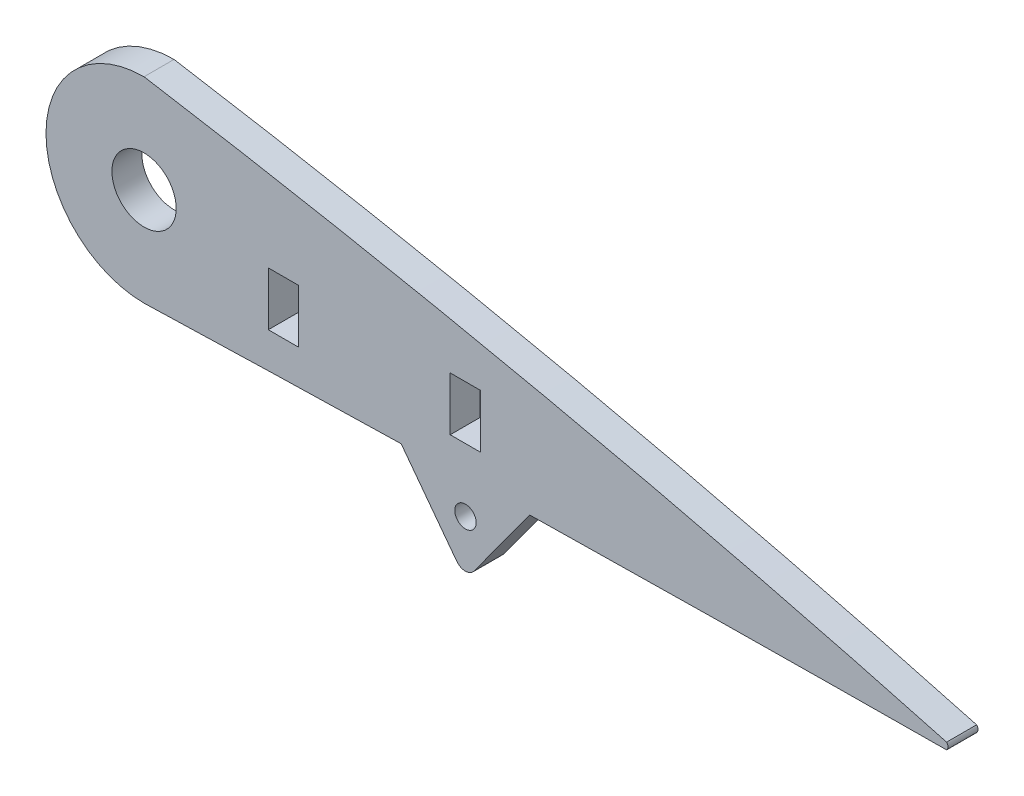
from build123d import *

# Parameters (mm, degrees)
SKETCH_1_R      = 1
SKETCH_1_R_2    = 3
SKETCH_1_W      = 2.8
SKETCH_1_H      = 5
SKETCH_1_W_2    = 2.85
EXTRUDE_1_DEPTH = 1.4


with BuildPart() as part:
    # Эскиз1 → Бобышка-Вытянуть1 (new, symmetric)
    with BuildSketch(Plane.XY):
        with BuildLine():
            ThreePointArc((175.091334091, 16.644787515), (168.620686799, 13.96455765), (165.940456932, 7.493910359))
            ThreePointArc((165.940456932, 7.493910359), (168.620686797, 1.023263065), (175.091334091, -1.656966802))
            add(Edge.make_bspline(
                [(175.091334091, -1.656966802), (177.330680613, -1.588466601), (181.854695323, -1.455127256), (188.663234462, -1.270383377), (194.423908611, -1.128102082), (197.899847219, -1.04871935), (199.091334091, -1.02226769)],
                knots=[0.704401069, 0.704401069, 0.704401069, 0.704401069, 0.730918775, 0.757971338, 0.785017763, 0.79912389, 0.79912389, 0.79912389, 0.79912389], degree=3))
            Line((199.091334091, -1.02226769), (204.279973699, -7.926463493))
            ThreePointArc((204.279973699, -7.926463493), (205.086497755, -8.325660965), (205.887265796, -7.915039218))
            Line((205.887265796, -7.915039218), (211.091334091, -0.78138581))
            add(Edge.make_bspline(
                [(211.091334091, -0.78138581), (215.029550732, -0.71061193), (221.226120504, -0.611852577), (229.617630172, -0.50292618), (236.087353854, -0.431514192), (241.980776913, -0.376520461), (246.558970011, -0.339535886), (249.120490965, -0.321271242), (250, -0.315)],
                knots=[0.846478182, 0.846478182, 0.846478182, 0.846478182, 0.893099152, 0.919831065, 0.945809917, 0.969680601, 0.989589706, 1, 1, 1, 1], degree=3))
            ThreePointArc((250, -0.315), (250.130477272, 0), (250, 0.315))
            add(Edge.make_bspline(
                [(250, 0.315), (249.15566774, 0.545019818), (246.720175698, 1.208516243), (242.391332083, 2.358339053), (236.849761204, 3.787625364), (230.779918279, 5.298008837), (224.455917947, 6.812866028), (218.030543496, 8.291610632), (211.562405045, 9.719735057), (205.072411509, 11.092374932), (198.567970913, 12.407850726), (192.052369914, 13.665297924), (185.527619973, 14.864093303), (179.872800983, 15.850364437), (176.392239334, 16.431323122), (175.091334091, 16.644787515)],
                knots=[0, 0, 0, 0, 0.0101622, 0.029313053, 0.052011605, 0.076619468, 0.101948061, 0.127526132, 0.153184131, 0.178867888, 0.204557903, 0.230245712, 0.255925967, 0.281594302, 0.296903142, 0.296903142, 0.296903142, 0.296903142], degree=3))
        make_face()
        with Locations((205.091334091, -3.906089643)):
            Circle(SKETCH_1_R, mode=Mode.SUBTRACT)
        with Locations((175.091334091, 7.493910357)):
            Circle(SKETCH_1_R_2, mode=Mode.SUBTRACT)
        with Locations((188.091334091, 4.493910357)):
            Rectangle(SKETCH_1_W, SKETCH_1_H, mode=Mode.SUBTRACT)
        with Locations((205.091334091, 4.493910357)):
            Rectangle(SKETCH_1_W_2, SKETCH_1_H, mode=Mode.SUBTRACT)
    extrude(amount=EXTRUDE_1_DEPTH, both=True)


solid = part.part
